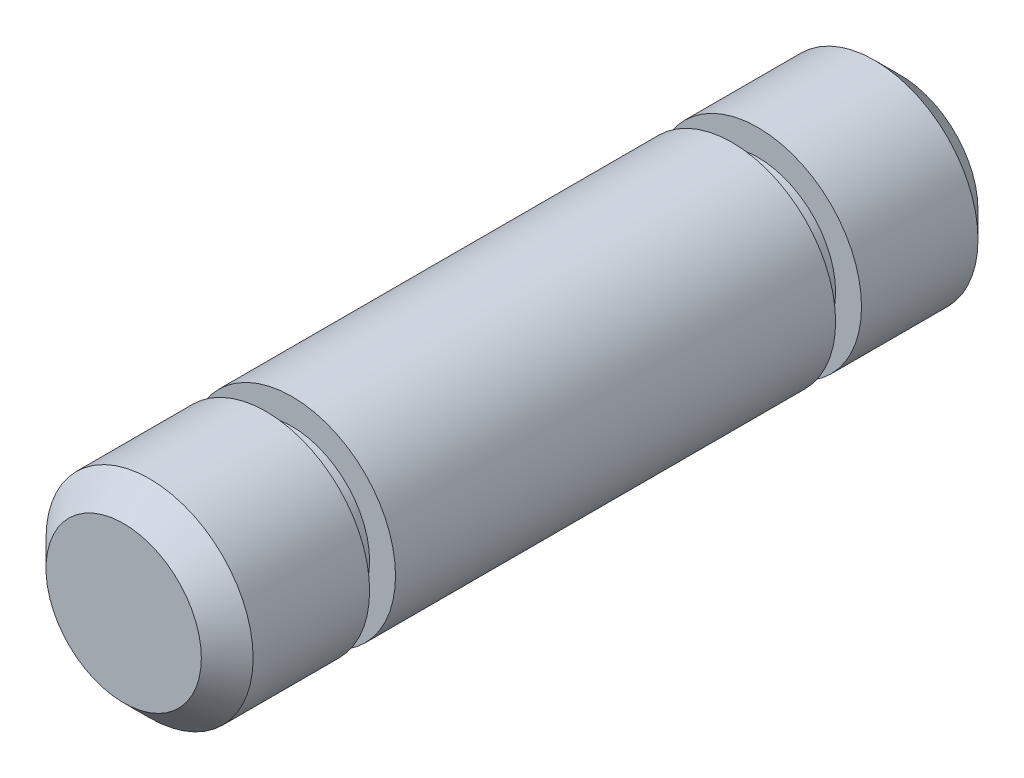
from build123d import *

# Parameters (mm, degrees)
SKETCH_1_R          = 8
EXTRUDE_1_DEPTH     = 60
CHAMFER_1_SIZE      = 2
SKETCH_3_OUTSIDE_W  = 30.824
SKETCH_3_OUTSIDE_H  = 30.824
SKETCH_3_OUTSIDE_R  = 6
CUT_EXTRUDE_1_DEPTH = 2
SKETCH_4_OUTSIDE_W  = 30.824
SKETCH_4_OUTSIDE_H  = 30.824
SKETCH_4_OUTSIDE_R  = 6
CUT_EXTRUDE_2_DEPTH = 2


with BuildPart() as part:
    # 草图1 → 凸台-拉伸1 (new body)
    with BuildSketch(Plane.XY):
        Circle(SKETCH_1_R)
    extrude(amount=EXTRUDE_1_DEPTH)

    # 倒角1
    chamfer_1_edges = [part.edges().sort_by_distance(p)[0] for p in [
        (-8, 0, 0),
        (-8, 0, 60),
    ]]
    chamfer(chamfer_1_edges, length=CHAMFER_1_SIZE)

    # 草图3 outside → 切除-拉伸1 (cut)
    with BuildSketch(Plane.XY.offset(13)):
        Rectangle(SKETCH_3_OUTSIDE_W, SKETCH_3_OUTSIDE_H)
        Circle(SKETCH_3_OUTSIDE_R, mode=Mode.SUBTRACT)
    extrude(amount=-CUT_EXTRUDE_1_DEPTH, mode=Mode.SUBTRACT)

    # 草图4 outside → 切除-拉伸2 (cut)
    with BuildSketch(Plane.XY.offset(47)):
        Rectangle(SKETCH_4_OUTSIDE_W, SKETCH_4_OUTSIDE_H)
        Circle(SKETCH_4_OUTSIDE_R, mode=Mode.SUBTRACT)
    extrude(amount=CUT_EXTRUDE_2_DEPTH, mode=Mode.SUBTRACT)


solid = part.part
